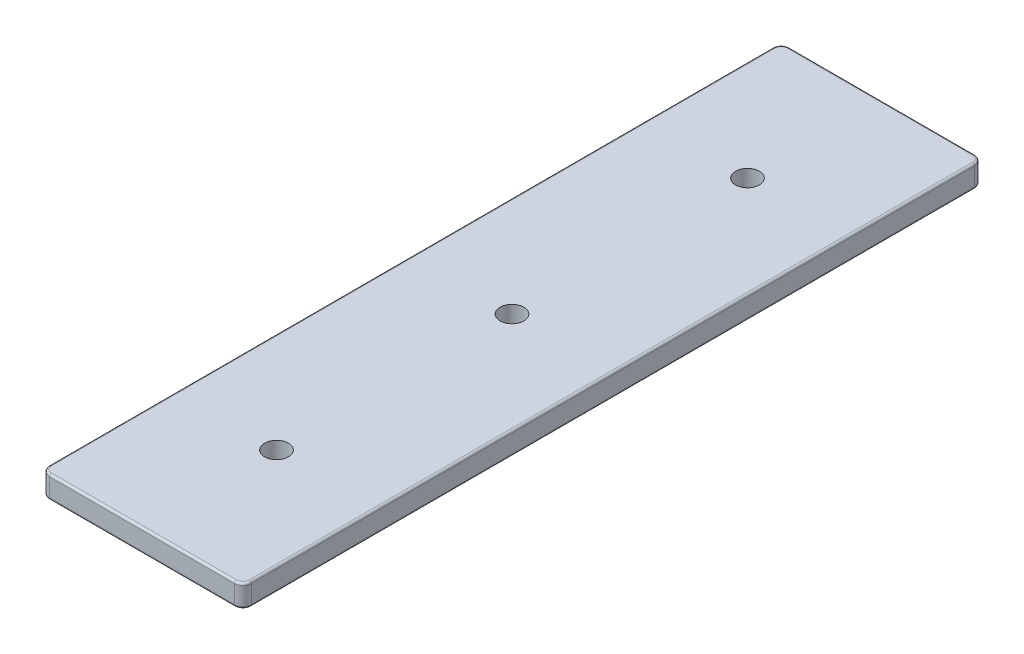
from build123d import *

# Parameters (mm, degrees)
BOSS_EXTRUDE1_DEPTH = 139.7
FILLET1_R           = 1.27
BOSS_EXTRUDE2_DEPTH = 25.4
FILLET2_R           = 1.27
FILLET3_R           = 1.27
FILLET4_R           = 1.27
SKETCH9_W           = 38.1
SKETCH9_H           = 139.7
BOSS_EXTRUDE3_DEPTH = 4.233333333
FILLET6_R           = 1.5875
FILLET7_R           = 0.396875
LPATTERN1_COUNT     = 2
LPATTERN1_PITCH     = 44.45
LPATTERN1_COL_COUNT = 2
LPATTERN1_COL_PITCH = 44.45
FILLET5_R           = 1.5875


with BuildPart() as part:
    # Sketch1 → Boss-Extrude1 (new body)
    with BuildSketch(Plane.XY):
        Polygon((-19.05, 0), (19.05, 0), (19.05, 12.7), (11.528846515, 12.7), (14.816666667, 4.7625), (-14.816666667, 4.7625), (-11.528846515, 12.7), (-19.05, 12.7), align=None)
    extrude(amount=BOSS_EXTRUDE1_DEPTH)

    # Fillet1
    fillet1_edges = [part.edges().sort_by_distance(p)[0] for p in [
        (-19.05, 12.7, 69.85),
        (-11.528846515, 12.7, 69.85),
        (-14.816666667, 4.7625, 69.85),
        (14.816666667, 4.7625, 69.85),
        (11.528846515, 12.7, 69.85),
        (19.05, 12.7, 69.85),
    ]]
    fillet(fillet1_edges, radius=FILLET1_R)

    # Fillet3
    fillet3_edges = [part.edges().sort_by_distance(p)[0] for p in [
        (19.05, 5.715, 0),
        (15.604767917, 12.7, 0),
        (15.604767917, 12.7, 139.7),
        (-19.05, 5.715, 0),
        (-15.604767917, 12.7, 0),
        (-13.172756591, 8.73125, 0),
        (0, 4.7625, 0),
        (13.172756591, 8.73125, 0),
        (-12.373569426, 12.135574196, 0),
        (-18.678025612, 12.328025612, 0),
        (12.373569426, 12.135574196, 0),
        (18.678025612, 12.328025612, 0),
        (13.172756591, 8.73125, 139.7),
        (0, 0, 139.7),
        (0, 4.7625, 139.7),
        (-13.172756591, 8.73125, 139.7),
        (-15.604767917, 12.7, 139.7),
        (-19.05, 5.715, 139.7),
        (-12.373569426, 12.135574196, 139.7),
        (-18.678025612, 12.328025612, 139.7),
        (12.373569426, 12.135574196, 139.7),
        (18.678025612, 12.328025612, 139.7),
        (13.971943756, 5.326925804, 0),
        (13.971943756, 5.326925804, 139.7),
        (-13.971943756, 5.326925804, 0),
        (-13.971943756, 5.326925804, 139.7),
        (19.05, 5.715, 139.7),
        (0, 0, 0),
    ]]
    fillet(fillet3_edges, radius=FILLET3_R)


with BuildPart() as body_2:
    # Sketch2 → Boss-Extrude2 (new body)
    with BuildSketch(Plane.XY.offset(139.7)):
        with BuildLine():
            Line((-11.904210726, 10.798189653), (11.904210726, 10.798189653))
            Line((11.904210726, 10.798189653), (13.737306252, 6.372705571))
            ThreePointArc((13.737306252, 6.372705571), (13.655153833, 5.538598063), (12.915977348, 5.1435))
            Line((12.915977348, 5.1435), (-12.915977348, 5.1435))
            ThreePointArc((-12.915977348, 5.1435), (-13.655153833, 5.538598063), (-13.737306252, 6.372705571))
            Line((-13.737306252, 6.372705571), (-11.904210726, 10.798189653))
        make_face()
    extrude(amount=BOSS_EXTRUDE2_DEPTH)

    # Fillet2
    fillet2_edges = [body_2.edges().sort_by_distance(p)[0] for p in [
        (-11.904210726, 10.798189653, 152.4),
        (11.904210726, 10.798189653, 152.4),
    ]]
    fillet(fillet2_edges, radius=FILLET2_R)

    # Fillet4
    fillet4_edges = [body_2.edges().sort_by_distance(p)[0] for p in [
        (-13.655153833, 5.538598063, 165.1),
        (0, 10.798189653, 139.7),
        (0, 10.798189653, 165.1),
        (0, 5.1435, 165.1),
        (-12.983128557, 8.193451592, 139.7),
        (-11.761198052, 10.584156061, 139.7),
        (11.761198052, 10.584156061, 139.7),
        (-12.983128557, 8.193451592, 165.1),
        (-11.761198052, 10.584156061, 165.1),
        (13.655153833, 5.538598063, 165.1),
        (11.761198052, 10.584156061, 165.1),
        (12.983128557, 8.193451592, 165.1),
        (13.655153833, 5.538598063, 139.7),
        (0, 5.1435, 139.7),
        (-13.655153833, 5.538598063, 139.7),
        (12.983128557, 8.193451592, 139.7),
    ]]
    fillet(fillet4_edges, radius=FILLET4_R)

    # Sketch4 → CSK for 1/4 Flat Head Machine Screw (100)1 (revolve, cut)
    with BuildSketch(Plane(origin=(0, 5.1435, 152.4), x_dir=(0, 0, -1), z_dir=(1, 0, 0))):
        Polygon((0, 0), (0, 7.5565), (3.3782, 7.5565), (3.3782, 2.568232241), (6.4389, 0), align=None)
    revolve(axis=Axis((0, -1.2065, 152.4), (0, 1, 0)), mode=Mode.SUBTRACT)


with BuildPart() as body_3:
    # Sketch9 → Boss-Extrude3 (new body)
    with BuildSketch(Plane(origin=(0, -0.396875, 0), x_dir=(-1, 0, 0), z_dir=(0, -1, 0))):
        with Locations((0, -69.85)):
            Rectangle(SKETCH9_W, SKETCH9_H)
    extrude(amount=BOSS_EXTRUDE3_DEPTH)

    # Fillet6
    fillet6_edges = [body_3.edges().sort_by_distance(p)[0] for p in [
        (19.05, -2.513541667, 0),
        (-19.05, -2.513541667, 0),
        (-19.05, -2.513541667, 139.7),
        (19.05, -2.513541667, 139.7),
    ]]
    fillet(fillet6_edges, radius=FILLET6_R)

    # Fillet7
    fillet7_edges = [body_3.edges().sort_by_distance(p)[0] for p in [
        (0, -0.396875, 139.7),
        (0, -4.630208333, 139.7),
        (19.05, -0.396875, 69.85),
        (0, -0.396875, 0),
        (-19.05, -0.396875, 69.85),
        (18.585032015, -0.396875, 0.464967985),
        (-18.585032015, -0.396875, 0.464967985),
        (-18.585032015, -0.396875, 139.235032015),
        (18.585032015, -0.396875, 139.235032015),
        (19.05, -4.630208333, 69.85),
        (-19.05, -4.630208333, 69.85),
        (0, -4.630208333, 0),
        (18.585032015, -4.630208333, 0.464967985),
        (-18.585032015, -4.630208333, 0.464967985),
        (-18.585032015, -4.630208333, 139.235032015),
        (18.585032015, -4.630208333, 139.235032015),
    ]]
    fillet(fillet7_edges, radius=FILLET7_R)


with BuildPart() as csk_for_8_flat_head_machine_screw_100_tool:
    # Sketch6 → CSK for #8 Flat Head Machine Screw (100)1 (revolve)
    with BuildSketch(Plane(origin=(0, 4.7625, 69.85), x_dir=(0, 0, 1), z_dir=(1, 0, 0))):
        Polygon((0, 0), (0, 9.392708333), (2.2479, 9.392708333), (2.2479, 1.651767624), (4.2164, 0), align=None)
    csk_for_8_flat_head_machine_screw_100 = revolve(axis=Axis((0, 11.1125, 69.85), (0, -1, 0)))


with BuildPart() as part_1:
    add(part.part)

    # CSK for #8 Flat Head Machine Screw (100)1: cut by csk_for_8_flat_head_machine_screw_100_tool
    add(csk_for_8_flat_head_machine_screw_100_tool.part, mode=Mode.SUBTRACT)


with BuildPart() as body_3_1:
    add(body_3.part)

    # CSK for #8 Flat Head Machine Screw (100)1: cut by csk_for_8_flat_head_machine_screw_100_tool
    add(csk_for_8_flat_head_machine_screw_100_tool.part, mode=Mode.SUBTRACT)


with BuildPart() as lpattern1_tool:
    # LPattern1: CSK for #8 Flat Head Machine Screw (100)1 ×2
    with Locations(*[(0, 0, i * LPATTERN1_PITCH) for i in range(1, LPATTERN1_COUNT)]):
        add(csk_for_8_flat_head_machine_screw_100)


with BuildPart() as part_2:
    add(part_1.part)

    # LPattern1: cut by lpattern1_tool
    add(lpattern1_tool.part, mode=Mode.SUBTRACT)


with BuildPart() as body_3_2:
    add(body_3_1.part)

    # LPattern1: cut by lpattern1_tool
    add(lpattern1_tool.part, mode=Mode.SUBTRACT)


with BuildPart() as lpattern1_col_tool:
    # LPattern1 col: CSK for #8 Flat Head Machine Screw (100)1 ×2
    with Locations(*[(0, 0, -i * LPATTERN1_COL_PITCH) for i in range(1, LPATTERN1_COL_COUNT)]):
        add(csk_for_8_flat_head_machine_screw_100)


with BuildPart() as part_3:
    add(part_2.part)

    # LPattern1 col: cut by lpattern1_col_tool
    add(lpattern1_col_tool.part, mode=Mode.SUBTRACT)

    # Fillet5
    fillet5_edges = [part_3.edges().sort_by_distance(p)[0] for p in [
        (0, 4.7625, 65.6336),
        (0, 4.7625, 21.1836),
        (0, 4.7625, 110.0836),
    ]]
    fillet(fillet5_edges, radius=FILLET5_R)


with BuildPart() as body_3_3:
    add(body_3_2.part)

    # LPattern1 col: cut by lpattern1_col_tool
    add(lpattern1_col_tool.part, mode=Mode.SUBTRACT)


solid = body_3_3.part
